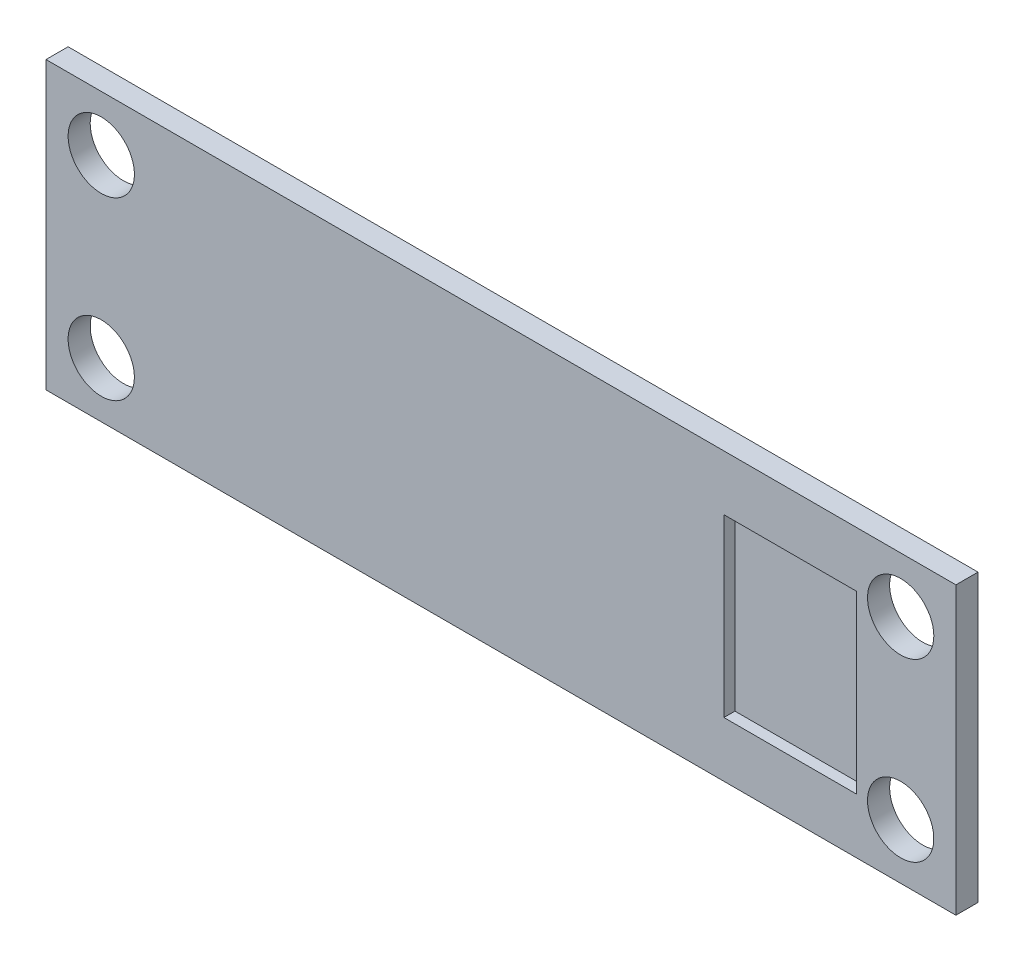
from build123d import *

# Parameters (mm, degrees)
CROQUIS1_W              = 41.18
CROQUIS1_H              = 12.95
CROQUIS1_R              = 1.5
SALIENTE_EXTRUIR1_DEPTH = 1
CROQUIS2_W              = 6
CROQUIS2_H              = 7.95
CORTAR_EXTRUIR1_DEPTH   = 0.5


with BuildPart() as part:
    # Croquis1 → Saliente-Extruir1 (new body)
    with BuildSketch(Plane.XY):
        with Locations((-20.59, 6.475)):
            Rectangle(CROQUIS1_W, CROQUIS1_H)
        with Locations((-38.68, 2.5)):
            Circle(CROQUIS1_R, mode=Mode.SUBTRACT)
        with Locations(Location((-38.68, 10.45, 0), (0, 0, 180))):
            Circle(CROQUIS1_R, mode=Mode.SUBTRACT)
        with Locations(Location((-2.5, 2.5, 0), (0, 0, 180))):
            Circle(CROQUIS1_R, mode=Mode.SUBTRACT)
        with Locations((-2.5, 10.45)):
            Circle(CROQUIS1_R, mode=Mode.SUBTRACT)
    extrude(amount=SALIENTE_EXTRUIR1_DEPTH)

    # Croquis2 → Cortar-Extruir1 (cut)
    with BuildSketch(Plane.XY.offset(1)):
        with Locations((-7.5, 6.475)):
            Rectangle(CROQUIS2_W, CROQUIS2_H)
    extrude(amount=-CORTAR_EXTRUIR1_DEPTH, mode=Mode.SUBTRACT)


solid = part.part
